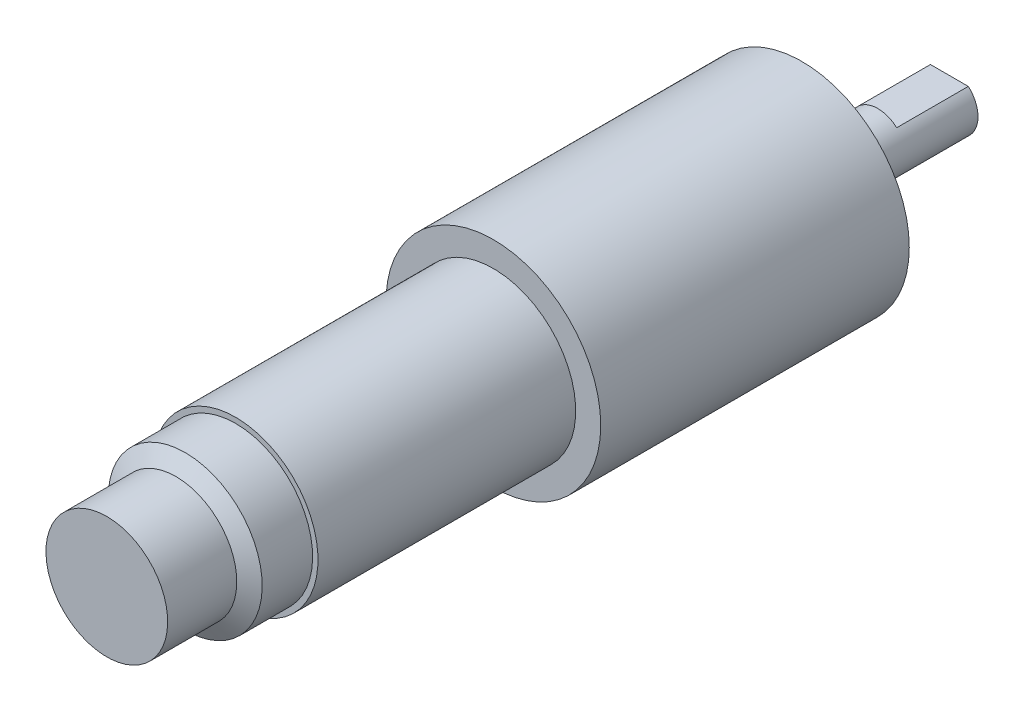
from build123d import *

# Parameters (mm, degrees)
CUT_EXTRUDE1_START = -10
CUT_EXTRUDE1_DEPTH = 10
SKETCH5_R          = 1.5
CUT_EXTRUDE2_DEPTH = 4


with BuildPart() as part:
    # Sketch1 → Revolve1 (revolve)
    with BuildSketch(Plane(origin=(0, 0, 0), x_dir=(0, 0, -1), z_dir=(1, 0, 0)), mode=Mode.PRIVATE) as revolve1_sk:
        Polygon((20.6, 0), (20.6, 4), (4, 4), (4, 9), (0, 9), (0, 15), (-43.1, 15), (-43.1, 0), align=None)
    revolve(revolve1_sk.sketch.rotate(Axis((0, 0, 0), (0, 0, -1)), 90), axis=Axis((0, 0, 0), (0, 0, -1)))

    # Sketch2 → Cut-Extrude1 (cut)
    with BuildSketch(Plane(origin=(0, 0, -20.6), x_dir=(-1, 0, 0), z_dir=(0, 0, -1)).offset(CUT_EXTRUDE1_START)):
        with BuildLine():
            Line((-2.645751311, 3), (2.645751311, 3))
            ThreePointArc((2.645751311, 3), (0, 4), (-2.645751311, 3))
        make_face()
    extrude(amount=CUT_EXTRUDE1_DEPTH, mode=Mode.SUBTRACT)

    # Sketch3 → Revolve2 (revolve)
    with BuildSketch(Plane(origin=(0, 0, 0), x_dir=(0, 0, -1), z_dir=(1, 0, 0)), mode=Mode.PRIVATE) as revolve2_sk:
        Polygon((-43.1, 11.5), (-79.1, 11.5), (-79.1, 10.5), (-85.1, 10.5), (-85.1, 4.5), (-86.6, 4.5), (-86.6, 3), (-88.2, 3), (-88.2, 1.5), (-93.9, 1.5), (-93.9, 0), (-43.1, 0), align=None)
    revolve(revolve2_sk.sketch.rotate(Axis((0, 0, 0), (0, 0, 1)), 90), axis=Axis((0, 0, 0), (0, 0, 1)))

    # Sketch5 → Cut-Extrude2 (cut)
    with BuildSketch(Plane(origin=(0, 0, 0), x_dir=(-1, 0, 0), z_dir=(0, 0, -1))):
        with Locations((0, 13)):
            Circle(SKETCH5_R)
        with Locations((13, 0)):
            Circle(SKETCH5_R)
        with Locations((0, -13)):
            Circle(SKETCH5_R)
        with Locations((-13, 0)):
            Circle(SKETCH5_R)
    extrude(amount=-CUT_EXTRUDE2_DEPTH, mode=Mode.SUBTRACT)


with BuildPart() as body_2:
    # Sketch4 → Revolve3 (revolve)
    with BuildSketch(Plane(origin=(0, 0, 0), x_dir=(0, 0, -1), z_dir=(1, 0, 0))):
        Polygon((-86.146092564, 10.75), (-79.1, 10.75), (-79.1, 0), (-97.1, 0), (-97.1, 8.5), (-87.44513067, 8.5), align=None)
    revolve(axis=Axis((0, 0, 79.1), (0, 0, 1)))


solid = Compound([part.part, body_2.part])
